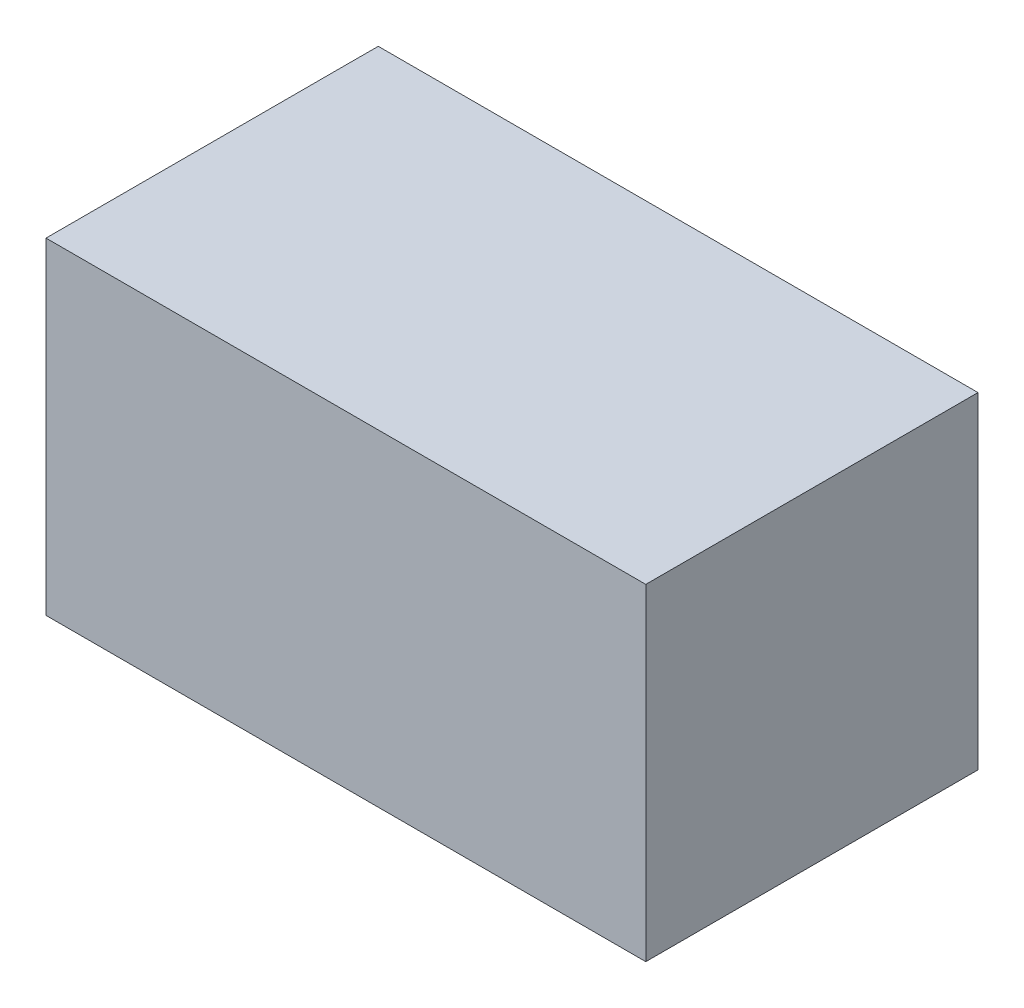
from build123d import *

# Parameters (mm, degrees)
SKETCH_1_W          = 82
SKETCH_1_H          = 30
EXTRUDE_1_DEPTH     = 1.5
SKETCH_2_W          = 1.997612732
SKETCH_2_H          = 25.79850023
EXTRUDE_3_DEPTH     = 3.5
SKETCH_4_W          = 1.75
SKETCH_4_H          = 25.79850023
EXTRUDE_4_DEPTH     = 26
SKETCH_5_W          = 55.064096776
SKETCH_5_H          = 30
EXTRUDE_5_DEPTH     = 29
SKETCH_6_W          = 26.352675357
SKETCH_6_H          = 28.194959652
CUT_EXTRUDE_1_DEPTH = 53
SKETCH_8_W          = 53
SKETCH_8_H          = 28.194959652
CUT_EXTRUDE_2_DEPTH = 1.32
CUT_EXTRUDE_5_DEPTH = 26.94
CUT_EXTRUDE_6_DEPTH = 26.94


with BuildPart() as part:
    # 草圖1 → 填料-伸長1 (new body)
    with BuildSketch(Plane.XY):
        Rectangle(SKETCH_1_W, SKETCH_1_H)
    extrude(amount=EXTRUDE_1_DEPTH)

    # 草圖2 → 填料-伸長3 (add)
    with BuildSketch(Plane(origin=(0, 0, 0), x_dir=(-1, 0, 0), z_dir=(0, 0, -1))):
        with Locations((40.001193634, 0)):
            Rectangle(SKETCH_2_W, SKETCH_2_H)
    extrude(amount=EXTRUDE_3_DEPTH)

    # 草圖4 → 填料-伸長4 (add)
    with BuildSketch(Plane(origin=(-39.002387268, 0, 0), x_dir=(0, 0, -1), z_dir=(1, 0, 0))):
        with Locations((2.625, 0)):
            Rectangle(SKETCH_4_W, SKETCH_4_H)
    extrude(amount=EXTRUDE_4_DEPTH)

    # 草圖5 → 填料-伸長5 (add)
    with BuildSketch(Plane.XY.offset(1.5)):
        with Locations((13.467951612, 0)):
            Rectangle(SKETCH_5_W, SKETCH_5_H)
    extrude(amount=EXTRUDE_5_DEPTH)

    # 草圖6 → 除料-伸長1 (cut)
    with BuildSketch(Plane.ZY.offset(14.064096776)):
        with Locations((15.993727328, -0.060074488)):
            Rectangle(SKETCH_6_W, SKETCH_6_H)
    extrude(amount=-CUT_EXTRUDE_1_DEPTH, mode=Mode.SUBTRACT)

    # 草圖8 → 除料-伸長2 (cut)
    with BuildSketch(Plane.XY.offset(2.817389649)):
        with Locations((12.435903224, -0.060074488)):
            Rectangle(SKETCH_8_W, SKETCH_8_H)
    extrude(amount=-CUT_EXTRUDE_2_DEPTH, mode=Mode.SUBTRACT)

    # 草圖10 → 除料-伸長5 (cut)
    with BuildSketch(Plane.ZY.offset(41)):
        Polygon((1.5, 15), (1.5, -16.079937927), (-4.357490946, -16.079937927), (-4.357490946, 16.240136561), (1.5, 16.240136561), align=None)
    extrude(amount=-CUT_EXTRUDE_5_DEPTH, mode=Mode.SUBTRACT)


with BuildPart() as cut_extrude_5_piece_1:
    # of the separate pieces the step leaves, piece 1, a body of its own (cut_extrude_5_pieces)
    add(part.part.solids().sort_by_distance((-14.06, 15, 0))[0])


with BuildPart() as cut_extrude_5_piece_2:
    # of the separate pieces the step leaves, piece 2, a body of its own (cut_extrude_5_pieces)
    add(part.part.solids().sort_by_distance((-14.06, 12.899250115, -1.75))[0])

    # 草圖11 → 除料-伸長6 (cut)
    with BuildSketch(Plane.ZY.offset(14.06)):
        Polygon((-1.75, 12.899250115), (-3.5, 12.899250115), (-4.749423893, -13.676958411), (-1.265103595, -13.676958411), (-1.265103595, 12.899250115), align=None)
    extrude(amount=-CUT_EXTRUDE_6_DEPTH, mode=Mode.SUBTRACT)


solid = cut_extrude_5_piece_1.part
